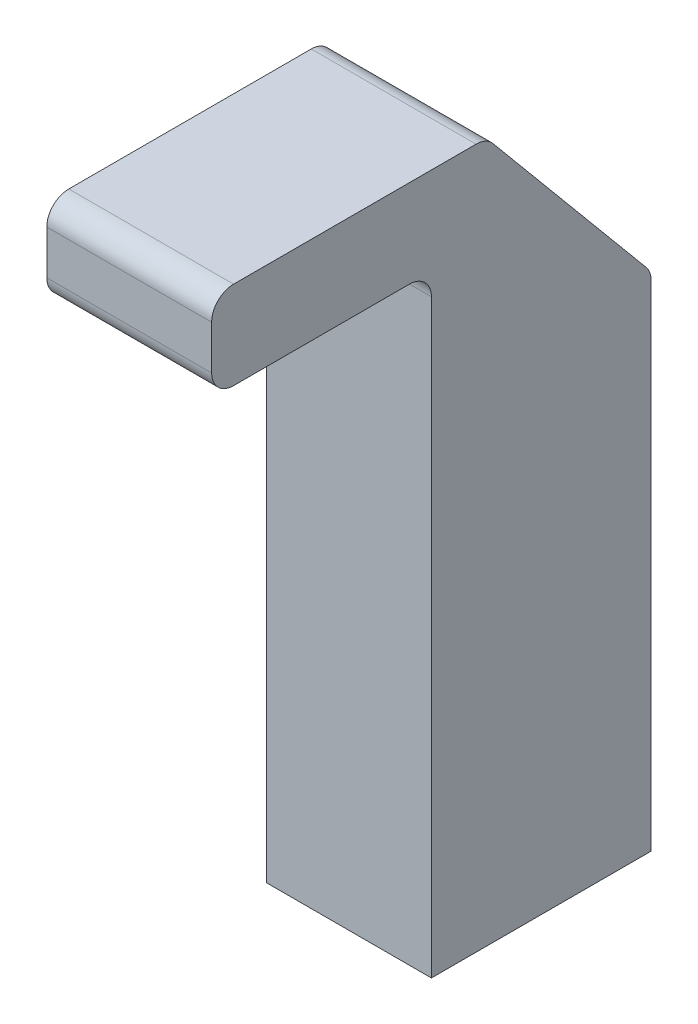
from build123d import *

# Parameters (mm, degrees)
BOSS_EXTRUDE1_DEPTH = 7.5
SKETCH2_R           = 2
CUT_EXTRUDE1_DEPTH  = 58.68
CUT_EXTRUDE2_REACH  = 77.574
SKETCH3_R           = 1.05
FILLET1_R           = 2


with BuildPart() as part:
    # Sketch1 → Boss-Extrude1 (new, symmetric)
    with BuildSketch(Plane(origin=(0, 0, 0), x_dir=(0, 0, -1), z_dir=(1, 0, 0))):
        Polygon((0, 0), (0, 8), (25, 8), (40, -10), (40, -55.68), (20, -55.68), (20, 0), align=None)
    extrude(amount=BOSS_EXTRUDE1_DEPTH, both=True)

    # Sketch2 → Cut-Extrude1 (cut)
    with BuildSketch(Plane(origin=(0, 8, 0), x_dir=(1, 0, 0), z_dir=(0, 1, 0))):
        with Locations(Location((-4, 31, 0), (0, 0, 270))):
            Circle(SKETCH2_R)
        with Locations(Location((4, 31, 0), (0, 0, 270))):
            Circle(SKETCH2_R)
    extrude(amount=-CUT_EXTRUDE1_DEPTH, mode=Mode.SUBTRACT)

    # Sketch3 → Cut-Extrude2 (cut, up to next)
    with BuildSketch(Plane(origin=(0, 8, 0), x_dir=(1, 0, 0), z_dir=(0, 1, 0)), mode=Mode.PRIVATE) as cut_extrude2_sk1:
        with Locations(Location((-4, 31, 0), (0, 0, 270))):
            Circle(SKETCH3_R)
    cut_extrude2_tool1 = extrude(cut_extrude2_sk1.sketch, amount=-CUT_EXTRUDE2_REACH, mode=Mode.PRIVATE) & part.part
    # Sketch3 → Cut-Extrude2 (cut, up to next)
    with BuildSketch(Plane(origin=(0, 8, 0), x_dir=(1, 0, 0), z_dir=(0, 1, 0)), mode=Mode.PRIVATE) as cut_extrude2_sk2:
        with Locations(Location((4, 31, 0), (0, 0, 270))):
            Circle(SKETCH3_R)
    cut_extrude2_tool2 = extrude(cut_extrude2_sk2.sketch, amount=-CUT_EXTRUDE2_REACH, mode=Mode.PRIVATE) & part.part
    add(cut_extrude2_tool1.solids().sort_by_distance((-4, 8, -31))[0], mode=Mode.SUBTRACT)
    add(cut_extrude2_tool2.solids().sort_by_distance((4, 8, -31))[0], mode=Mode.SUBTRACT)

    # Fillet1
    fillet1_edges = [part.edges().sort_by_distance(p)[0] for p in [
        (0, 0, 0),
        (0, 8, 0),
        (0, 8, -25),
        (0, -10, -40),
        (0, 0, -20),
    ]]
    fillet(fillet1_edges, radius=FILLET1_R)


solid = part.part
